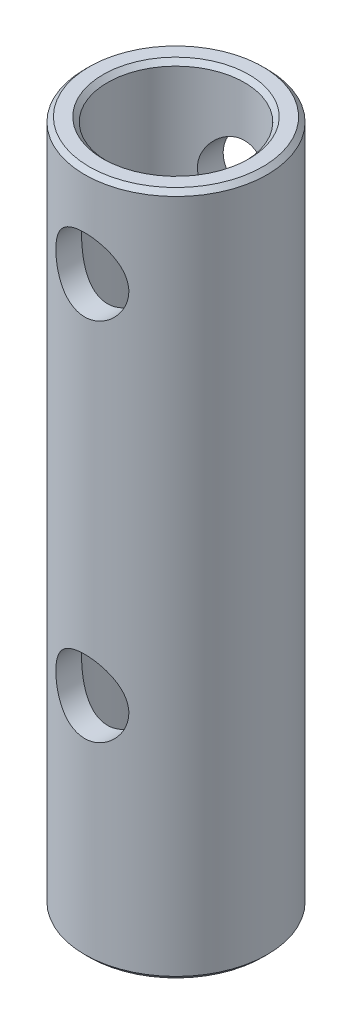
from build123d import *

# Parameters (mm, degrees)
SKIZZE1_R                       = 4
SKIZZE1_R_2                     = 3
AUFSATZ_LINEAR_AUSTRAGEN1_DEPTH = 30
FASE1_SIZE                      = 0.2
SKIZZE2_R                       = 1.6
SCHNITT_LINEAR_AUSTRAGEN1_DEPTH = 6


with BuildPart() as part:
    # Skizze1 → Aufsatz-Linear austragen1 (new body)
    with BuildSketch(Plane(origin=(0, 0, 0), x_dir=(1, 0, 0), z_dir=(0, 1, 0))):
        with Locations(Location((0, 0, 0), (0, 0, 270))):
            Circle(SKIZZE1_R)
        with Locations(Location((0, 0, 0), (0, 0, 270))):
            Circle(SKIZZE1_R_2, mode=Mode.SUBTRACT)
    extrude(amount=AUFSATZ_LINEAR_AUSTRAGEN1_DEPTH)

    # Fase1
    fase1_edges = [part.edges().sort_by_distance(p)[0] for p in [
        (0, 0, -4),
        (0, 30, -4),
        (0, 0, -3),
        (0, 30, -3),
    ]]
    chamfer(fase1_edges, length=FASE1_SIZE)

    # Skizze2 → Schnitt-Linear austragen1 (cut, symmetric)
    with BuildSketch(Plane.XY):
        with Locations((0, 26)):
            Circle(SKIZZE2_R)
        with Locations((0, 10)):
            Circle(SKIZZE2_R)
    extrude(amount=SCHNITT_LINEAR_AUSTRAGEN1_DEPTH, both=True, mode=Mode.SUBTRACT)


solid = part.part
